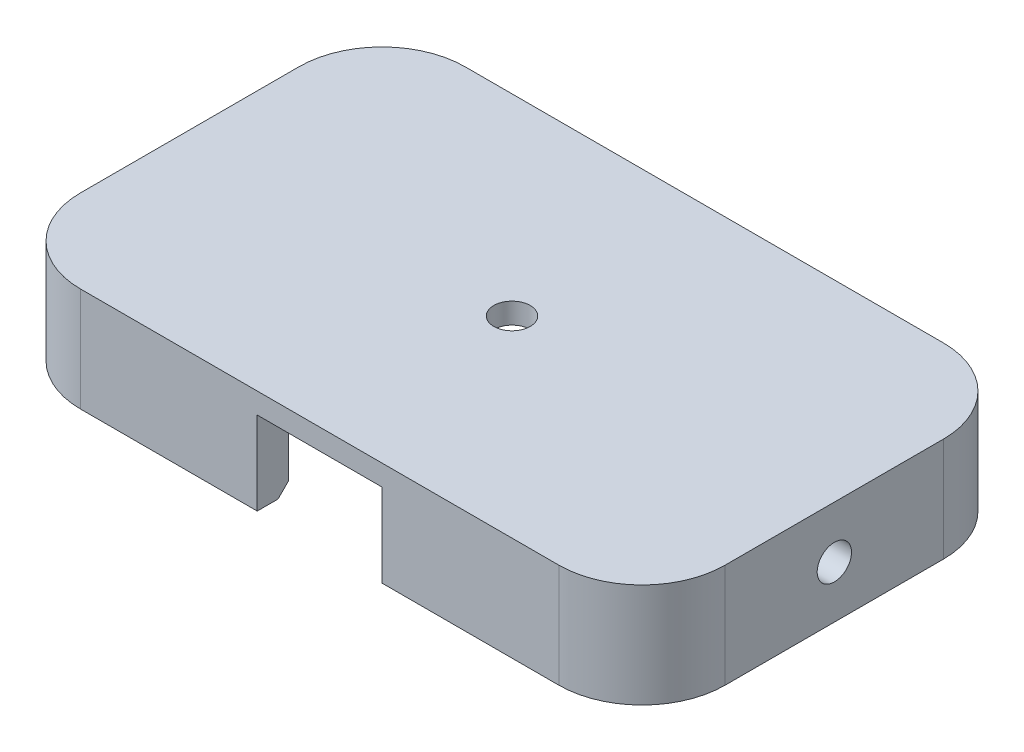
from build123d import *

# Parameters (mm, degrees)
BOSS_EXTRUDE1_DEPTH        = 10
BOSS_EXTRUDE2_DEPTH        = 2
F_3_5_3_5_DIAMETER_HOLE1_D = 3.5
SKETCH8_W                  = 12
SKETCH8_H                  = 8
CUT_EXTRUDE1_DEPTH         = 5
CHAMFER1_SIZE              = 1


with BuildPart() as part:
    # Sketch1 → Boss-Extrude1 (new body)
    with BuildSketch(Plane(origin=(0, 0, 0), x_dir=(1, 0, 0), z_dir=(0, 1, 0))):
        with BuildLine():
            Line((-23, 18.5), (23, 18.5))
            ThreePointArc((23, 18.5), (28.656854249, 16.156854249), (31, 10.5))
            Line((31, 10.5), (31, -10.5))
            ThreePointArc((31, -10.5), (28.656854249, -16.156854249), (23, -18.5))
            Line((23, -18.5), (-23, -18.5))
            ThreePointArc((-23, -18.5), (-28.656854249, -16.156854249), (-31, -10.5))
            Line((-31, -10.5), (-31, 10.5))
            ThreePointArc((-31, 10.5), (-28.656854249, 16.156854249), (-23, 18.5))
        make_face()
        with BuildLine():
            Line((-23, -15.5), (23, -15.5))
            ThreePointArc((23, -15.5), (26.535533906, -14.035533906), (28, -10.5))
            Line((28, -10.5), (28, 10.5))
            ThreePointArc((28, 10.5), (26.535533906, 14.035533906), (23, 15.5))
            Line((23, 15.5), (-23, 15.5))
            ThreePointArc((-23, 15.5), (-26.535533906, 14.035533906), (-28, 10.5))
            Line((-28, 10.5), (-28, -10.5))
            ThreePointArc((-28, -10.5), (-26.535533906, -14.035533906), (-23, -15.5))
        make_face(mode=Mode.SUBTRACT)
    extrude(amount=-BOSS_EXTRUDE1_DEPTH)

    # Sketch1<2> → Boss-Extrude2 (add)
    with BuildSketch(Plane(origin=(0, 0, 0), x_dir=(1, 0, 0), z_dir=(0, 1, 0))):
        with BuildLine():
            ThreePointArc((-28, -10.5), (-26.535533906, -14.035533906), (-23, -15.5))
            Line((-23, -15.5), (23, -15.5))
            ThreePointArc((23, -15.5), (26.535533906, -14.035533906), (28, -10.5))
            Line((28, -10.5), (28, 10.5))
            ThreePointArc((28, 10.5), (26.535533906, 14.035533906), (23, 15.5))
            Line((23, 15.5), (-23, 15.5))
            ThreePointArc((-23, 15.5), (-26.535533906, 14.035533906), (-28, 10.5))
            Line((-28, 10.5), (-28, -10.5))
        make_face()
    extrude(amount=-BOSS_EXTRUDE2_DEPTH)

    # Sketch4 → Ø3.3 (3.3) Diameter Hole1 (revolve, cut)
    with BuildSketch(Plane(origin=(31, -5, 0), x_dir=(0, 0, -1), z_dir=(0, 1, 0))):
        Polygon((0, 0), (0, 10.991420021), (1.65, 10), (1.65, 0), align=None)
    f_3_3_3_3_diameter_hole1 = revolve(axis=Axis((37.35, -5, 0), (-1, 0, 0)), mode=Mode.SUBTRACT)

    # Mirror1: Ø3.3 (3.3) Diameter Hole1 across plane
    add(f_3_3_3_3_diameter_hole1.mirror(Plane(origin=(0, 0, 0), x_dir=(0, 0, 1), z_dir=(1, 0, 0))), mode=Mode.SUBTRACT)

    # Ø3.5 (3.5) Diameter Hole1 (through all)
    with Locations(Plane(origin=(0, -2, 0), x_dir=(-1, 0, 0), z_dir=(0, -1, 0))):
        with Locations((0, 0)):
            Hole(F_3_5_3_5_DIAMETER_HOLE1_D / 2)

    # Sketch8 → Cut-Extrude1 (cut)
    with BuildSketch(Plane.XY.offset(18.5)):
        with Locations((0, -6)):
            Rectangle(SKETCH8_W, SKETCH8_H)
    extrude(amount=-CUT_EXTRUDE1_DEPTH, mode=Mode.SUBTRACT)

    # Chamfer1
    chamfer1_edges = [part.edges().sort_by_distance(p)[0] for p in [
        (14.5, -10, 15.5),
        (26.535533906, -10, 14.035533906),
        (28, -10, 0),
        (26.535533906, -10, -14.035533906),
        (0, -10, -15.5),
        (-14.5, -10, 15.5),
        (-26.535533906, -10, -14.035533906),
        (-26.535533906, -10, 14.035533906),
        (-28, -10, 0),
    ]]
    chamfer(chamfer1_edges, length=CHAMFER1_SIZE)


solid = part.part
